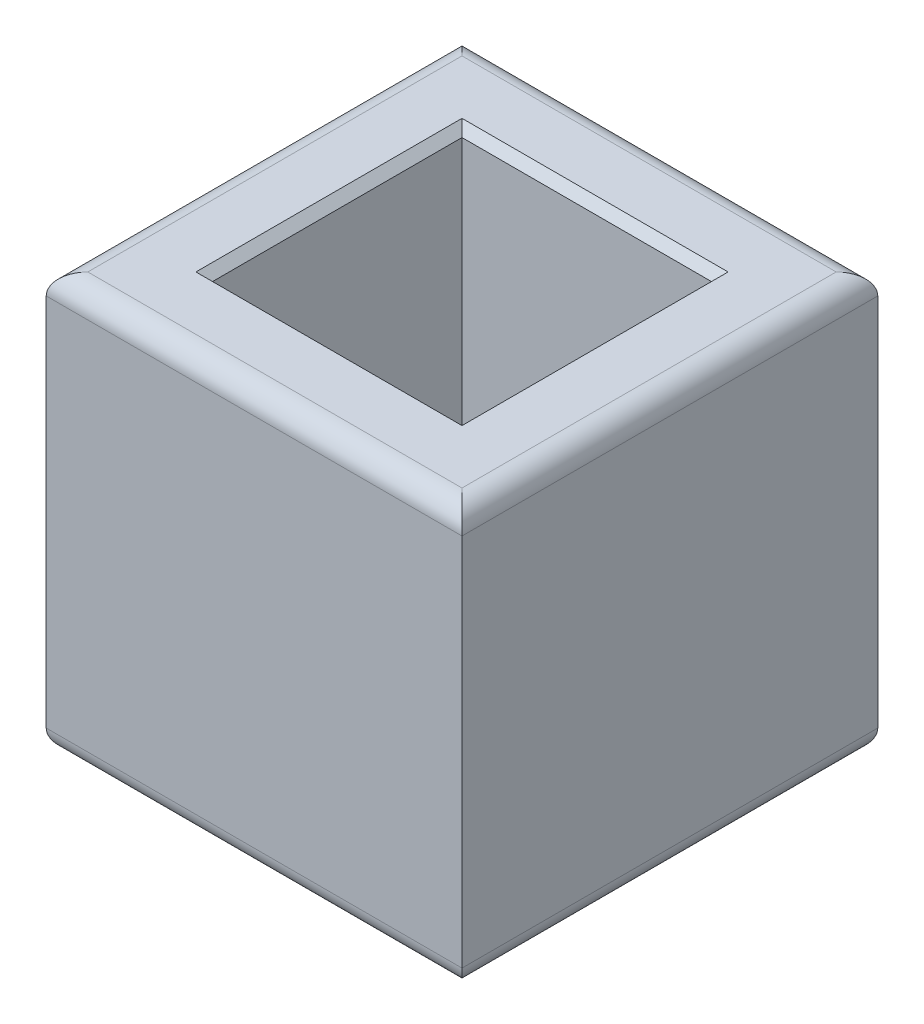
from build123d import *

# Parameters (mm, degrees)
SKETCH1_W           = 127
SKETCH1_H           = 127
BOSS_EXTRUDE1_DEPTH = 127
SKETCH2_W           = 76.2
SKETCH2_H           = 76.2
CUT_EXTRUDE1_DEPTH  = 156.542598667
CHAMFER1_SIZE       = 2.54
FILLET1_R           = 6.35


with BuildPart() as part:
    # Sketch1 → Boss-Extrude1 (new body)
    with BuildSketch(Plane(origin=(0, 0, 0), x_dir=(1, 0, 0), z_dir=(0, 1, 0))):
        Rectangle(SKETCH1_W, SKETCH1_H)
    extrude(amount=BOSS_EXTRUDE1_DEPTH)

    # Sketch2 → Cut-Extrude1 (cut, through all)
    with BuildSketch(Plane(origin=(0, 127, 0), x_dir=(1, 0, 0), z_dir=(0, 1, 0))):
        Rectangle(SKETCH2_W, SKETCH2_H)
    extrude(amount=-CUT_EXTRUDE1_DEPTH, mode=Mode.SUBTRACT)

    # Chamfer1
    chamfer1_edges = [part.edges().sort_by_distance(p)[0] for p in [
        (0, 0, 38.1),
        (-38.1, 0, 0),
        (0, 0, -38.1),
        (38.1, 127, 0),
        (0, 127, -38.1),
        (-38.1, 127, 0),
        (0, 127, 38.1),
    ]]
    chamfer(chamfer1_edges, length=CHAMFER1_SIZE)

    # Fillet1
    fillet1_edges = [part.edges().sort_by_distance(p)[0] for p in [
        (-63.5, 127, 0),
        (0, 127, 63.5),
        (63.5, 127, 0),
        (0, 0, 63.5),
        (-63.5, 0, 0),
        (0, 0, -63.5),
        (63.5, 0, 0),
        (0, 127, -63.5),
    ]]
    fillet(fillet1_edges, radius=FILLET1_R)


solid = part.part
